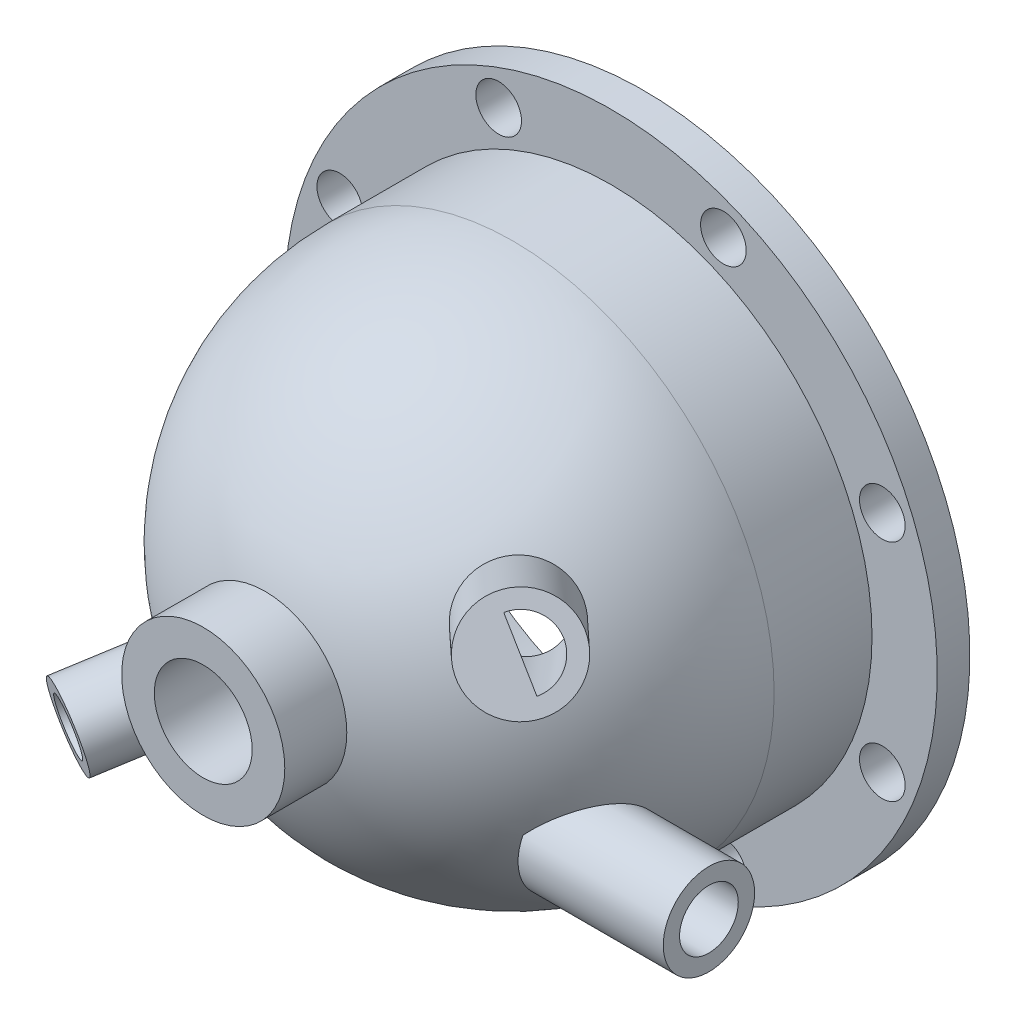
from build123d import *

# Parameters (mm, degrees)
SWEEP_2_PROFILE_R    = 15
SWEEP_4_PROFILE_R    = 12
SWEEP_4_2_PROFILE_R  = 8
SWEEP_8_PROFILE_R    = 15
SWEEP_10_PROFILE_R   = 9
SWEEP_10_2_PROFILE_R = 14
SWEEP_12_PROFILE_R   = 25
SWEEP_12_2_PROFILE_R = 9
SWEEP_14_PROFILE_R   = 15
SKETCH_70_R          = 7
CUT_EXTRUDE_2_DEPTH  = 10
SWEEP_16_PROFILE_R   = 10


with BuildPart() as part:
    # 草图1 → 旋转1 (revolve)
    with BuildSketch(Plane(origin=(0, 0, 0), x_dir=(1, 0, 0), z_dir=(0, 1, 0))):
        with BuildLine():
            Line((100, 40), (100, 30))
            Line((100, 30), (80, 30))
            Line((80, 30), (80, 0))
            ThreePointArc((80, 0), (56.568542495, -56.568542495), (0, -80))
            Line((0, -80), (0, -72))
            ThreePointArc((0, -72), (50.911688245, -50.911688245), (72, 0))
            Line((72, 0), (72, 40))
            Line((72, 40), (100, 40))
        make_face()
    revolve(axis=Axis((0, 0, -40), (0, 0, 1)))

    # 扫描2: sweep along a curve in space
    with BuildLine() as sweep_2_path:
        Line((49.75, 28.72, 48.21), (72.97, 42.13, 70.71))
    # 扫描2 profile (on start of the path) → 扫描2 (sweep)
    with BuildSketch(Plane(origin=(49.75, 28.72, 48.21), x_dir=(-0.6958849567674447, 0, 0.7181532753840031), z_dir=(0.6633618324626375, 0.38310431409663964, 0.642792473316509))):
        Circle(SWEEP_2_PROFILE_R)
    sweep(path=sweep_2_path.line)

    # Sweep 4: sweep along a curve in space
    with BuildLine() as sweep_4_path:
        Line((-31.1769, -18, 62.3538), (-45.4664, -26.25, 90.9326))
    # Sweep 4 profile (on start of the path) → Sweep 4 (sweep)
    with BuildSketch(Plane(origin=(-31.1769, -18, 62.3538), x_dir=(0.8944259391230801, 0, 0.4472160992448686), z_dir=(-0.4330151277192014, -0.2499999862614795, 0.8660241948326755))):
        Circle(SWEEP_4_PROFILE_R)
    sweep(path=sweep_4_path.line)

    # Sweep 4 2: sweep along a curve in space
    with BuildLine() as sweep_4_2_path:
        Line((0, 0, 0), (-45.466, -26.25, 90.933))
    # Sweep 4 2 profile (on start of the path) → Sweep 4 2 (sweep, cut)
    with BuildSketch(Plane(origin=(0, 0, 0), x_dir=(0.8944291582180298, 0, 0.44720966104209625), z_dir=(-0.43300893183467903, -0.24999965822065554, 0.8660273874658618))):
        Circle(SWEEP_4_2_PROFILE_R)
    sweep(path=sweep_4_2_path.line, mode=Mode.SUBTRACT)

    # 切除-扫描8: sweep along a curve in space
    with BuildLine() as sweep_8_path:
        Line((0, 0, 0), (0, 0, 95))
    # 切除-扫描8 profile (on start of the path) → 切除-扫描8 (sweep, cut)
    with BuildSketch(Plane.XY):
        Circle(SWEEP_8_PROFILE_R)
    sweep(path=sweep_8_path.line, mode=Mode.SUBTRACT)

    # Sweep 10: sweep along a curve in space
    with BuildLine() as sweep_10_path:
        Line((-20, -30, 40), (100, -30, 40))
    # Sweep 10 profile (on start of the path) → Sweep 10 (sweep, cut)
    with BuildSketch(Plane(origin=(-20, -30, 40), x_dir=(0, 0, 1), z_dir=(1, 0, 0))):
        Circle(SWEEP_10_PROFILE_R)
    sweep(path=sweep_10_path.line, mode=Mode.SUBTRACT)

    # Sweep 10 2: sweep along a curve in space
    with BuildLine() as sweep_10_2_path:
        Line((55.5, -30, 40), (100, -30, 40))
    # Sweep 10 2 profile (on start of the path) → Sweep 10 2 (sweep)
    with BuildSketch(Plane(origin=(55.5, -30, 40), x_dir=(0, 0, 1), z_dir=(1, 0, 0))):
        Circle(SWEEP_10_2_PROFILE_R)
    sweep(path=sweep_10_2_path.line)

    # Sweep 12: sweep along a curve in space
    with BuildLine() as sweep_12_path:
        Line((0, 0, 72), (0, 0, 95))
    # Sweep 12 profile (on start of the path) → Sweep 12 (sweep)
    with BuildSketch(Plane.XY.offset(72)):
        Circle(SWEEP_12_PROFILE_R)
    sweep(path=sweep_12_path.line)

    # Sweep 12 2: sweep along a curve in space
    with BuildLine() as sweep_12_2_path:
        Line((-20, -30, 40), (100, -30, 40))
    # Sweep 12 2 profile (on start of the path) → Sweep 12 2 (sweep, cut)
    with BuildSketch(Plane(origin=(-20, -30, 40), x_dir=(0, 0, 1), z_dir=(1, 0, 0))):
        Circle(SWEEP_12_2_PROFILE_R)
    sweep(path=sweep_12_2_path.line, mode=Mode.SUBTRACT)

    # 切除-扫描14: sweep along a curve in space
    with BuildLine() as sweep_14_path:
        Line((0, 0, 60), (0, 0, 95))
    # 切除-扫描14 profile (on start of the path) → 切除-扫描14 (sweep, cut)
    with BuildSketch(Plane.XY.offset(60)):
        Circle(SWEEP_14_PROFILE_R)
    sweep(path=sweep_14_path.line, mode=Mode.SUBTRACT)

    # 草图50 → 切除-旋转2 (revolve, cut)
    with BuildSketch(Plane(origin=(0, 0, 0), x_dir=(1, 0, 0), z_dir=(0, 1, 0))):
        with BuildLine():
            Line((0, -72), (0, 72))
            ThreePointArc((0, 72), (72, 0), (0, -72))
        make_face()
    revolve(axis=Axis((0, 0, -72), (0, 0, 1)), mode=Mode.SUBTRACT)

    # 草图70 → 切除-拉伸2 (cut)
    with BuildSketch(Plane.XY.offset(-40)):
        with Locations((83.149158, 34.441509)):
            Circle(SKETCH_70_R)
        with Locations((34.441509, 83.149158)):
            Circle(SKETCH_70_R)
        with Locations((-34.441509, 83.149158)):
            Circle(SKETCH_70_R)
        with Locations((-83.149158, 34.441509)):
            Circle(SKETCH_70_R)
        with Locations((-83.149158, -34.441509)):
            Circle(SKETCH_70_R)
        with Locations((-34.441509, -83.149158)):
            Circle(SKETCH_70_R)
        with Locations((34.441509, -83.149158)):
            Circle(SKETCH_70_R)
        with Locations((83.149158, -34.441509)):
            Circle(SKETCH_70_R)
    extrude(amount=CUT_EXTRUDE_2_DEPTH, mode=Mode.SUBTRACT)

    # 切除-扫描16: sweep along a curve in space
    with BuildLine() as sweep_16_path:
        Line((34.47, 19.92, 28.92), (72.976, 42.132, 70.707))
    # 切除-扫描16 profile (on start of the path) → 切除-扫描16 (sweep, cut)
    with BuildSketch(Plane(origin=(34.47, 19.92, 28.92), x_dir=(0.7353874638430953, 0, -0.6776468682303642), z_dir=(0.6311408885149005, 0.36407057122767805, 0.6849188258549873))):
        Circle(SWEEP_16_PROFILE_R)
    sweep(path=sweep_16_path.line, mode=Mode.SUBTRACT)


solid = part.part
